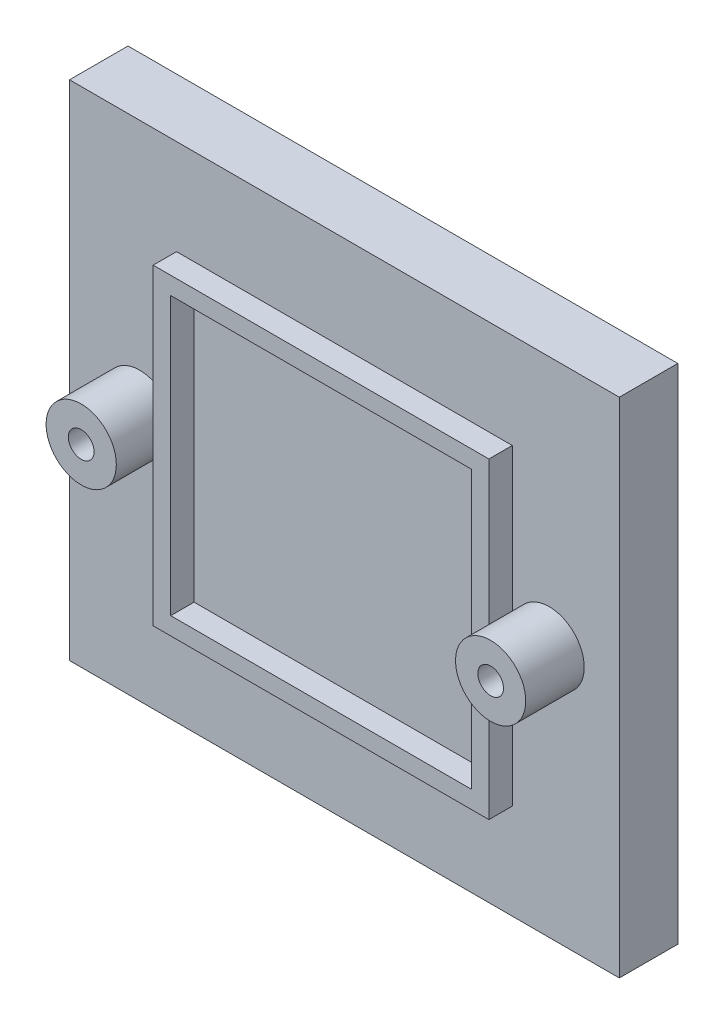
from build123d import *

# Parameters (mm, degrees)
SKETCH_1_W        = 28.7
SKETCH_1_H        = 26.7
SKETCH_1_W_2      = 25.7
SKETCH_1_H_2      = 23.7
EXTRUDE_2_DEPTH   = 2
SKETCH_1_7_R      = 3
SKETCH_1_7_R_2    = 1.1
EXTRUDE_5_DEPTH   = 5
EXTRUDE_5_2_DEPTH = 5
SKETCH_1_8_W      = 47
SKETCH_1_8_H      = 43
EXTRUDE_6_DEPTH   = 5


with BuildPart() as part:
    # 草图1 → 凸台-拉伸2 (new body)
    with BuildSketch(Plane.XY):
        Rectangle(SKETCH_1_W, SKETCH_1_H)
        Rectangle(SKETCH_1_W_2, SKETCH_1_H_2, mode=Mode.SUBTRACT)
    extrude(amount=EXTRUDE_2_DEPTH)



with BuildPart() as body_2:
    # 草图1<7> → 凸台-拉伸5 (new body)
    with BuildSketch(Plane.XY):
        with Locations((17.5, 0)):
            Circle(SKETCH_1_7_R)
        with Locations((17.5, 0)):
            Circle(SKETCH_1_7_R_2, mode=Mode.SUBTRACT)
    extrude(amount=EXTRUDE_5_DEPTH)


with BuildPart() as body_3:
    # 草图1<7> → Extrude 5 2 (new body)
    with BuildSketch(Plane.XY):
        with Locations((-17.5, 0)):
            Circle(SKETCH_1_7_R)
        with Locations((-17.5, 0)):
            Circle(SKETCH_1_7_R_2, mode=Mode.SUBTRACT)
    extrude(amount=EXTRUDE_5_2_DEPTH)


with BuildPart() as part_1:
    add(part.part)

    add(body_2.part)  # 凸台-拉伸6 merges body 2

    add(body_3.part)  # 凸台-拉伸6 merges body 3
    # 草图1<8> → 凸台-拉伸6 (add)
    with BuildSketch(Plane.XY):
        Rectangle(SKETCH_1_8_W, SKETCH_1_8_H)
    extrude(amount=-EXTRUDE_6_DEPTH)


solid = part_1.part
